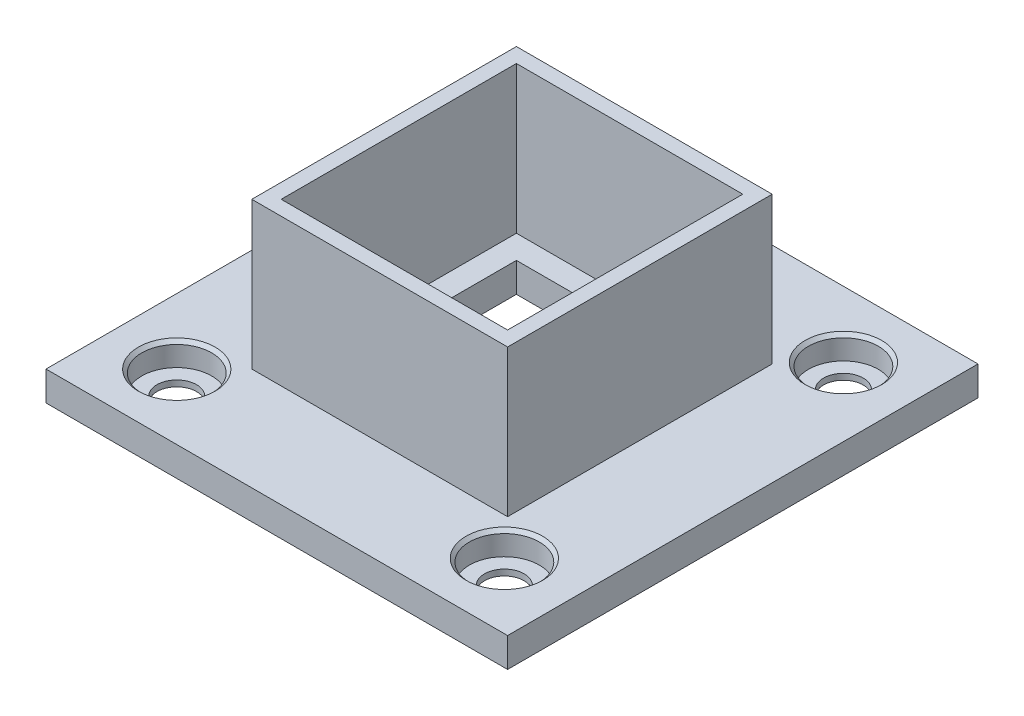
from build123d import *

# Parameters (mm, degrees)
SKETCH1_W                                    = 157
SKETCH1_H                                    = 160
BOSS_EXTRUDE1_DEPTH                          = 10
SKETCH2_W                                    = 61
SKETCH2_H                                    = 64
CUT_EXTRUDE1_DEPTH                           = 10
CBORE_SLOT_FOR_M12_HEX_HEAD_BOLT1_AT_2_COUNT = 2
CBORE_SLOT_FOR_M12_HEX_HEAD_BOLT1_AT_2_PITCH = 111.420621054
CBORE_SLOT_FOR_M12_HEX_HEAD_BOLT1_AT_3_COUNT = 2
CBORE_SLOT_FOR_M12_HEX_HEAD_BOLT1_AT_3_PITCH = 160.357529077
CBORE_SLOT_FOR_M12_HEX_HEAD_BOLT1_AT_4_COUNT = 2
CBORE_SLOT_FOR_M12_HEX_HEAD_BOLT1_AT_4_PITCH = 115.325549362
SKETCH7_W                                    = 87
SKETCH7_H                                    = 90
SKETCH7_W_2                                  = 77
SKETCH7_H_2                                  = 80
EXTRUDE_THIN1_DEPTH                          = 50


with BuildPart() as part:
    # Sketch1 → Boss-Extrude1 (new body)
    with BuildSketch(Plane(origin=(0, 0, 0), x_dir=(1, 0, 0), z_dir=(0, 1, 0))):
        with Locations((-1.646853147, -10.283216783)):
            Rectangle(SKETCH1_W, SKETCH1_H)
    extrude(amount=BOSS_EXTRUDE1_DEPTH)

    # Sketch2 → Cut-Extrude1 (cut)
    with BuildSketch(Plane(origin=(0, 10, 0), x_dir=(1, 0, 0), z_dir=(0, 1, 0))):
        with Locations((-1.646853147, -10.283216783)):
            Rectangle(SKETCH2_W, SKETCH2_H)
    extrude(amount=-CUT_EXTRUDE1_DEPTH, mode=Mode.SUBTRACT)

    # Sketch4 → CBORE SLOT for M12 Hex Head Bolt1 (revolve, cut)
    with BuildSketch(Plane(origin=(-57.877820781, 10, -47.249393621), x_dir=(0, 0, 1), z_dir=(1, 0, 0))):
        Polygon((0, 0), (0, 22.055809178), (6.75, 18), (6.75, 7.95), (11.89, 7.95), (11.89, 1.135), (13.025, 0), align=None)
    cbore_slot_for_m12_hex_head_bolt1 = revolve(axis=Axis((-57.877820781, 16.35, -47.249393621), (0, -1, 0)), mode=Mode.SUBTRACT)

    # CBORE SLOT for M12 Hex Head Bolt1 at 2: CBORE SLOT for M12 Hex Head Bolt1 ×2
    with Locations(*[(i * CBORE_SLOT_FOR_M12_HEX_HEAD_BOLT1_AT_2_PITCH, 0, 0) for i in range(1, CBORE_SLOT_FOR_M12_HEX_HEAD_BOLT1_AT_2_COUNT)]):
        add(cbore_slot_for_m12_hex_head_bolt1, mode=Mode.SUBTRACT)

    # CBORE SLOT for M12 Hex Head Bolt1 at 3: CBORE SLOT for M12 Hex Head Bolt1 ×2
    with Locations(*[Vector(0.6948262529067781, 0, 0.7191776402750062) * (i * CBORE_SLOT_FOR_M12_HEX_HEAD_BOLT1_AT_3_PITCH) for i in range(1, CBORE_SLOT_FOR_M12_HEX_HEAD_BOLT1_AT_3_COUNT)]):
        add(cbore_slot_for_m12_hex_head_bolt1, mode=Mode.SUBTRACT)

    # CBORE SLOT for M12 Hex Head Bolt1 at 4: CBORE SLOT for M12 Hex Head Bolt1 ×2
    with Locations(*[(0, 0, i * CBORE_SLOT_FOR_M12_HEX_HEAD_BOLT1_AT_4_PITCH) for i in range(1, CBORE_SLOT_FOR_M12_HEX_HEAD_BOLT1_AT_4_COUNT)]):
        add(cbore_slot_for_m12_hex_head_bolt1, mode=Mode.SUBTRACT)

    # Sketch7 → Extrude-Thin1 (add)
    with BuildSketch(Plane(origin=(0, 10, 0), x_dir=(1, 0, 0), z_dir=(0, 1, 0))):
        with Locations((-1.646853147, -10.283216783)):
            Rectangle(SKETCH7_W, SKETCH7_H)
        with Locations((-1.646853147, -10.283216783)):
            Rectangle(SKETCH7_W_2, SKETCH7_H_2, mode=Mode.SUBTRACT)
    extrude(amount=EXTRUDE_THIN1_DEPTH)


solid = part.part
